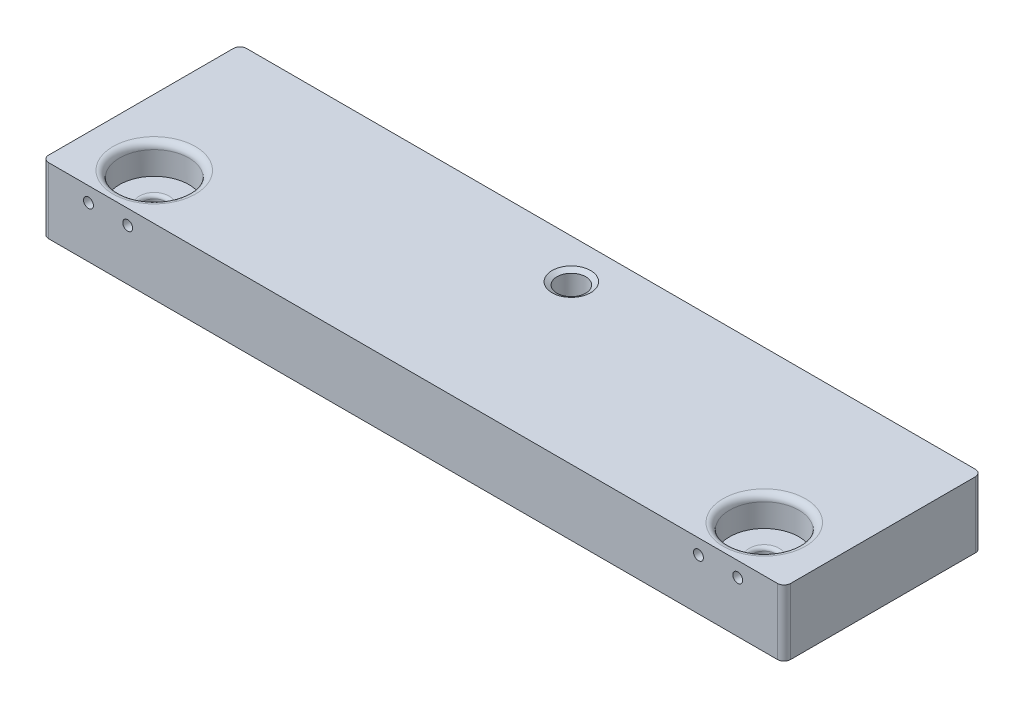
from build123d import *
from OCP.BRepFilletAPI import BRepFilletAPI_MakeChamfer

# Parameters (mm, degrees)
SKETCH1_W           = 225
SKETCH1_H           = 60
SKETCH1_R           = 3.5
SKETCH1_R_2         = 4.3498
BOSS_EXTRUDE1_DEPTH = 20
SKETCH2_R           = 10.5
CUT_EXTRUDE1_DEPTH  = 9
CUT_EXTRUDE2_REACH  = 131.059
SKETCH3_R           = 1.5
FILLET1_R           = 2
FILLET2_R           = 1
CHAMFER1_SIZE       = 1.5
CHAMFER1_SIZE2      = 0.866025404


with BuildPart() as part:
    # Sketch1 → Boss-Extrude1 (new body)
    with BuildSketch(Plane(origin=(0, 0, 0), x_dir=(1, 0, 0), z_dir=(0, 1, 0))):
        Rectangle(SKETCH1_W, SKETCH1_H)
        with Locations(Location((92.5, -16, 0), (0, 0, 270))):
            Circle(SKETCH1_R, mode=Mode.SUBTRACT)
        with Locations(Location((-92.5, -16, 0), (0, 0, 90))):
            Circle(SKETCH1_R, mode=Mode.SUBTRACT)
        with Locations(Location((0, 18, 0), (0, 0, 270))):
            Circle(SKETCH1_R_2, mode=Mode.SUBTRACT)
    extrude(amount=BOSS_EXTRUDE1_DEPTH)

    # Sketch2 → Cut-Extrude1 (cut)
    with BuildSketch(Plane(origin=(0, 20, 0), x_dir=(1, 0, 0), z_dir=(0, 1, 0))):
        with Locations(Location((-92.5, -16, 0), (0, 0, 270))):
            Circle(SKETCH2_R)
        with Locations(Location((92.5, -16, 0), (0, 0, 90))):
            Circle(SKETCH2_R)
    extrude(amount=-CUT_EXTRUDE1_DEPTH, mode=Mode.SUBTRACT)

    # Sketch3 → Cut-Extrude2 (cut, up to next)
    with BuildSketch(Plane.XY.offset(30), mode=Mode.PRIVATE) as cut_extrude2_sk1:
        with Locations((-98.45, 15.5)):
            Circle(SKETCH3_R)
    cut_extrude2_tool1 = extrude(cut_extrude2_sk1.sketch, amount=-CUT_EXTRUDE2_REACH, mode=Mode.PRIVATE) & part.part
    # Sketch3 → Cut-Extrude2 (cut, up to next)
    with BuildSketch(Plane.XY.offset(30), mode=Mode.PRIVATE) as cut_extrude2_sk2:
        with Locations((-86.55, 15.5)):
            Circle(SKETCH3_R)
    cut_extrude2_tool2 = extrude(cut_extrude2_sk2.sketch, amount=-CUT_EXTRUDE2_REACH, mode=Mode.PRIVATE) & part.part
    # Sketch3 → Cut-Extrude2 (cut, up to next)
    with BuildSketch(Plane.XY.offset(30), mode=Mode.PRIVATE) as cut_extrude2_sk3:
        with Locations((98.45, 15.5)):
            Circle(SKETCH3_R)
    cut_extrude2_tool3 = extrude(cut_extrude2_sk3.sketch, amount=-CUT_EXTRUDE2_REACH, mode=Mode.PRIVATE) & part.part
    # Sketch3 → Cut-Extrude2 (cut, up to next)
    with BuildSketch(Plane.XY.offset(30), mode=Mode.PRIVATE) as cut_extrude2_sk4:
        with Locations((86.55, 15.5)):
            Circle(SKETCH3_R)
    cut_extrude2_tool4 = extrude(cut_extrude2_sk4.sketch, amount=-CUT_EXTRUDE2_REACH, mode=Mode.PRIVATE) & part.part
    add(cut_extrude2_tool1.solids().sort_by_distance((-98.45, 15.5, 30))[0], mode=Mode.SUBTRACT)
    add(cut_extrude2_tool2.solids().sort_by_distance((-86.55, 15.5, 30))[0], mode=Mode.SUBTRACT)
    add(cut_extrude2_tool3.solids().sort_by_distance((98.45, 15.5, 30))[0], mode=Mode.SUBTRACT)
    add(cut_extrude2_tool4.solids().sort_by_distance((86.55, 15.5, 30))[0], mode=Mode.SUBTRACT)

    # Fillet1
    fillet1_edges = [part.edges().sort_by_distance(p)[0] for p in [
        (-92.5, 20, 5.5),
        (92.5, 20, 26.5),
        (112.5, 10, 30),
        (-112.5, 10, 30),
        (-112.5, 10, -30),
        (112.5, 10, -30),
    ]]
    fillet(fillet1_edges, radius=FILLET1_R)

    # Fillet2
    fillet2_edges = [part.edges().sort_by_distance(p)[0] for p in [
        (92.5, 0, 12.5),
        (-92.5, 0, 19.5),
        (-92.5, 11, 19.5),
        (92.5, 11, 12.5),
    ]]
    fillet(fillet2_edges, radius=FILLET2_R)

    # Chamfer1: one chamfer whose edges measure the first distance from different faces: ONE call of the kernel's chamfer builder (chamfer() names one face for all edges)
    chamfer1_edges_1 = [part.edges().sort_by_distance(p)[0] for p in [
        (0, 0, -22.3498),
    ]]
    chamfer1_side_1 = [part.faces().sort_by_distance(p)[0] for p in [
        (0, 10, -22.3498),
    ]]
    chamfer1_edges_2 = [part.edges().sort_by_distance(p)[0] for p in [
        (0, 20, -22.3498),
    ]]
    chamfer1_side_2 = [part.faces().sort_by_distance(p)[0] for p in [
        (0, 20, -1.175236935),
    ]]
    chamfer1 = BRepFilletAPI_MakeChamfer(part.part.solid().wrapped)
    for e in chamfer1_edges_1:
        chamfer1.Add(CHAMFER1_SIZE, CHAMFER1_SIZE2, e.wrapped, chamfer1_side_1[0].wrapped)  # the first distance lies on this face
    for e in chamfer1_edges_2:
        chamfer1.Add(CHAMFER1_SIZE, CHAMFER1_SIZE2, e.wrapped, chamfer1_side_2[0].wrapped)  # the first distance lies on this face
    add(Compound.cast(chamfer1.Shape()), mode=Mode.REPLACE)


solid = part.part
